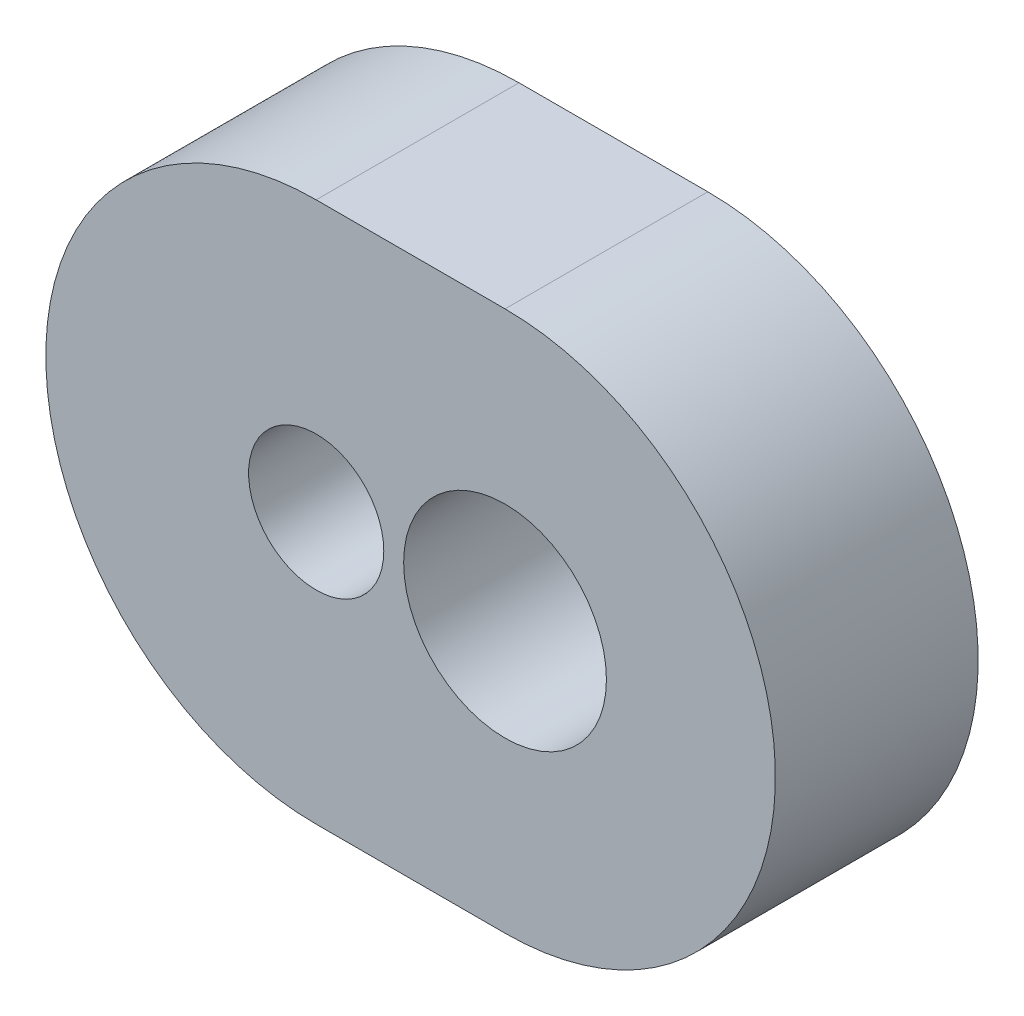
from build123d import *

# Parameters (mm, degrees)
SKETCH_1_R      = 1
SKETCH_1_R_2    = 1.5
EXTRUDE_1_DEPTH = 3


with BuildPart() as part:
    # 스케치1 → 보스-돌출1 (new body)
    with BuildSketch(Plane.XY):
        with BuildLine():
            Line((-2.794, 4), (0, 4))
            ThreePointArc((0, 4), (4, 0), (0, -4))
            Line((0, -4), (-2.794, -4))
            ThreePointArc((-2.794, -4), (-6.794, 0), (-2.794, 4))
        make_face()
        with Locations((-2.794, 0)):
            Circle(SKETCH_1_R, mode=Mode.SUBTRACT)
        Circle(SKETCH_1_R_2, mode=Mode.SUBTRACT)
    extrude(amount=EXTRUDE_1_DEPTH)


solid = part.part
